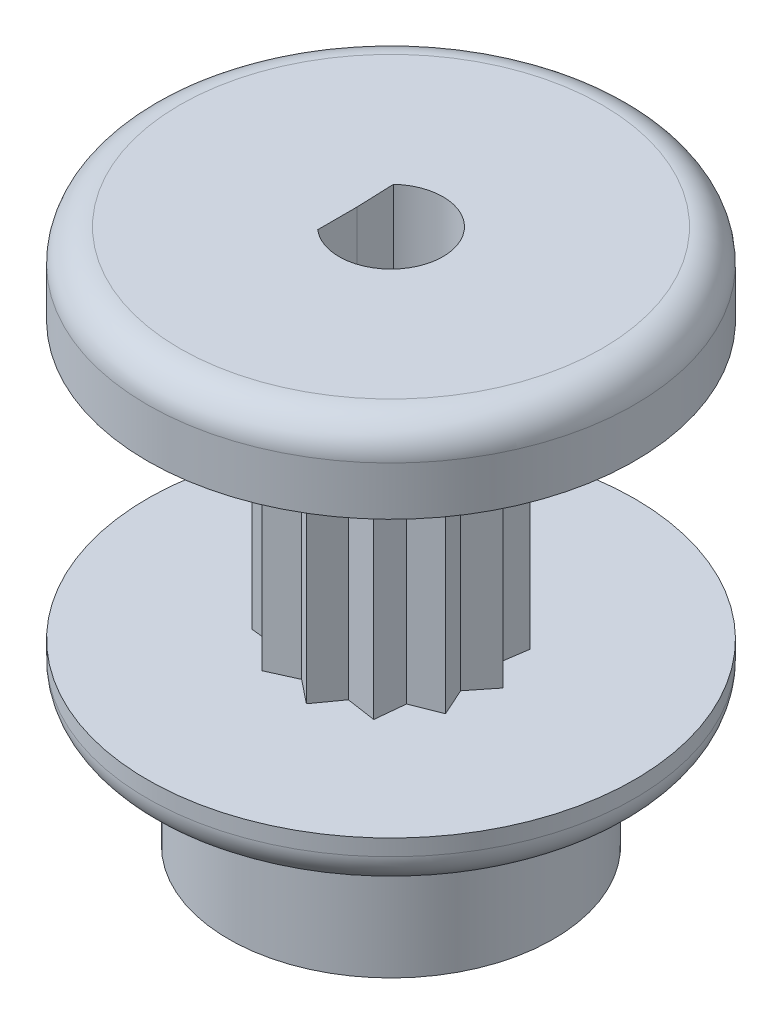
from build123d import *

# Parameters (mm, degrees)
BOSS_EXTRU_2_DEPTH      = 8.5
ESQUISSE2_R             = 7.5
BOSS_EXTRU_3_DEPTH      = 2.5
BOSS_EXTRU_4_START      = 1.5
ESQUISSE3_R             = 7.5
BOSS_EXTRU_4_DEPTH      = 1.5
ESQUISSE4_R             = 5
BOSS_EXTRU_5_DEPTH      = 4
ESQUISSE6_R             = 3
ENL_V_MAT_EXTRU_2_DEPTH = 0.1
CONG_4_R                = 1
ENL_V_MAT_EXTRU_3_DEPTH = 20.531001075


with BuildPart() as part:
    # Esquisse1 → Boss.-Extru.2 (new body)
    with BuildSketch(Plane(origin=(0, 0, 0), x_dir=(1, 0, 0), z_dir=(0, 1, 0))):
        Polygon((2.408977243, 1.875974594), (1.487996247, 1.96815707), (1.148248192, 2.829130277), (0.304564016, 2.448472144), (-0.420153034, 3.024222787), (-0.960475898, 2.272721085), (-1.875974594, 2.408977243), (-1.96815707, 1.487996247), (-2.829130277, 1.148248192), (-2.448472144, 0.304564016), (-3.024222787, -0.420153034), (-2.272721085, -0.960475898), (-2.408977243, -1.875974594), (-1.487996247, -1.96815707), (-1.148248192, -2.829130277), (-0.304564016, -2.448472144), (0.420153034, -3.024222787), (0.960475898, -2.272721085), (1.875974594, -2.408977243), (1.96815707, -1.487996247), (2.829130277, -1.148248192), (2.448472144, -0.304564016), (3.024222787, 0.420153034), (2.272721085, 0.960475898), align=None)
    extrude(amount=BOSS_EXTRU_2_DEPTH)

    # Esquisse2 → Boss.-Extru.3 (add)
    with BuildSketch(Plane(origin=(0, 8.5, 0), x_dir=(1, 0, 0), z_dir=(0, 1, 0))):
        with Locations(Location((0, 0, 0), (0, 0, 270))):
            Circle(ESQUISSE2_R)
    extrude(amount=BOSS_EXTRU_3_DEPTH)

    # Esquisse3 → Boss.-Extru.4 (add)
    with BuildSketch(Plane.XZ.offset(BOSS_EXTRU_4_START)):
        with Locations(Location((0, 0, 0), (0, 0, 90))):
            Circle(ESQUISSE3_R)
    extrude(amount=-BOSS_EXTRU_4_DEPTH)

    # Esquisse4 → Boss.-Extru.5 (add)
    with BuildSketch(Plane.XZ.offset(1.5)):
        with Locations(Location((0, 0, 0), (0, 0, 270))):
            Circle(ESQUISSE4_R)
    extrude(amount=BOSS_EXTRU_5_DEPTH)

    # Esquisse6 → Enlèv. mat.-Extru.2 (cut)
    with BuildSketch(Plane.XZ.offset(5.5)):
        with Locations(Location((0, 0, 0), (0, 0, 270))):
            Circle(ESQUISSE6_R)
    extrude(amount=-ENL_V_MAT_EXTRU_2_DEPTH, mode=Mode.SUBTRACT)

    # Congé4
    cong_4_edges = [part.edges().sort_by_distance(p)[0] for p in [
        (0, 11, -7.5),
        (0, -1.5, -7.5),
    ]]
    fillet(cong_4_edges, radius=CONG_4_R)

    # Esquisse7 → Enlèv. mat.-Extru.3 (cut, through all)
    with BuildSketch(Plane.XZ.offset(5.4)):
        with BuildLine():
            Line((-1.048275862, 0), (-1.092437897, -1.169007888))
            ThreePointArc((-1.092437897, -1.169007888), (1.599724111, -0.029711421), (-1.048275862, 1.208767023))
            Line((-1.048275862, 1.208767023), (-1.048275862, 0))
        make_face()
    extrude(amount=-ENL_V_MAT_EXTRU_3_DEPTH, mode=Mode.SUBTRACT)


solid = part.part
